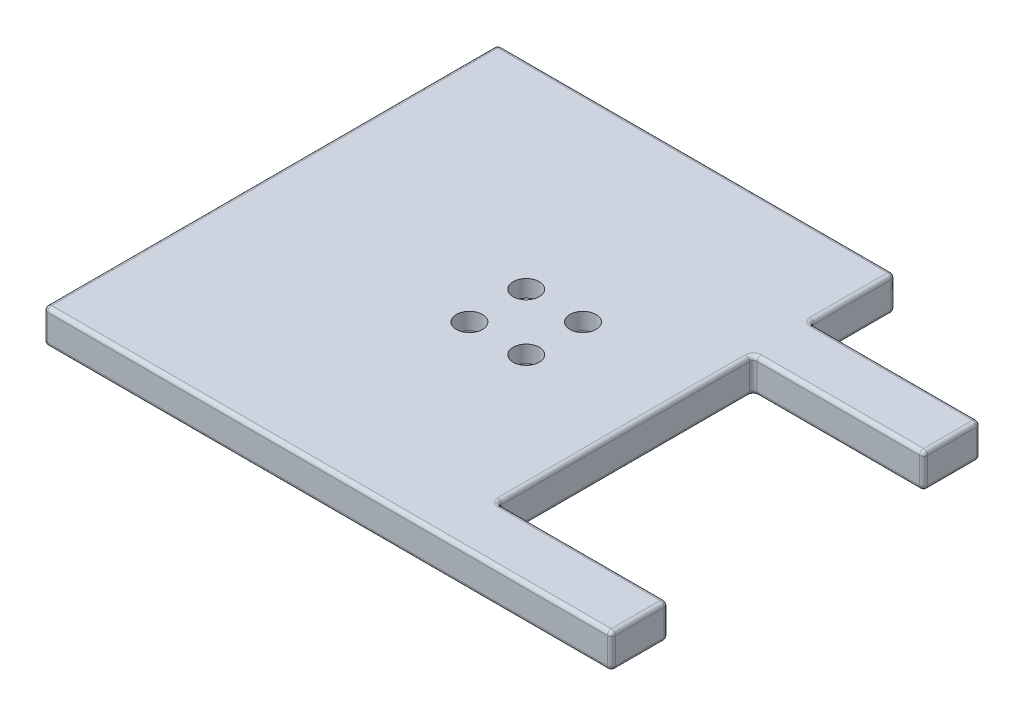
from build123d import *

# Parameters (mm, degrees)
EXTRUDE_1_DEPTH              = 6
FILLET_2_R                   = 0.7
HOLE_WIZARD_M2_1_D           = 2.2
HOLE_WIZARD_M2_1_CBORE_D     = 4.6
HOLE_WIZARD_M2_1_CBORE_DEPTH = 3


with BuildPart() as part:
    # 草图1 → 凸台-拉伸1 (new body)
    with BuildSketch(Plane(origin=(0, 0, 0), x_dir=(1, 0, 0), z_dir=(0, 1, 0))):
        Polygon((-60, 40), (10, 40), (10, 25), (40, 25), (40, 15), (10, 15), (10, -30), (40, -30), (40, -40), (-60, -40), align=None)
    extrude(amount=EXTRUDE_1_DEPTH)

    # 圆角2
    fillet_2_edges = [part.edges().sort_by_distance(p)[0] for p in [
        (-25, 0, -40),
        (10, 0, -32.5),
        (25, 0, -25),
        (40, 0, -20),
        (25, 0, -15),
        (10, 0, 7.5),
        (25, 0, 30),
        (40, 6, 35),
        (40, 0, 35),
        (-10, 0, 40),
        (-60, 0, 0),
        (25, 6, 30),
        (-60, 3, -40),
        (10, 3, -40),
        (10, 3, -25),
        (40, 3, -25),
        (40, 3, -15),
        (10, 3, -15),
        (10, 3, 30),
        (40, 3, 30),
        (40, 3, 40),
        (-60, 3, 40),
        (10, 6, 7.5),
        (25, 6, -15),
        (40, 6, -20),
        (25, 6, -25),
        (10, 6, -32.5),
        (-25, 6, -40),
        (-60, 6, 0),
        (-10, 6, 40),
    ]]
    fillet(fillet_2_edges, radius=FILLET_2_R)

    # M2 六角头机械螺钉的柱形沉头孔1 (through all)
    with Locations(Plane(origin=(0, 6, 0), x_dir=(1, 0, 0), z_dir=(0, 1, 0))):
        with Locations((-20, 5), (-10, 5), (-10, -5), (-20, -5)):
            CounterBoreHole(HOLE_WIZARD_M2_1_D / 2, HOLE_WIZARD_M2_1_CBORE_D / 2, HOLE_WIZARD_M2_1_CBORE_DEPTH)


solid = part.part
